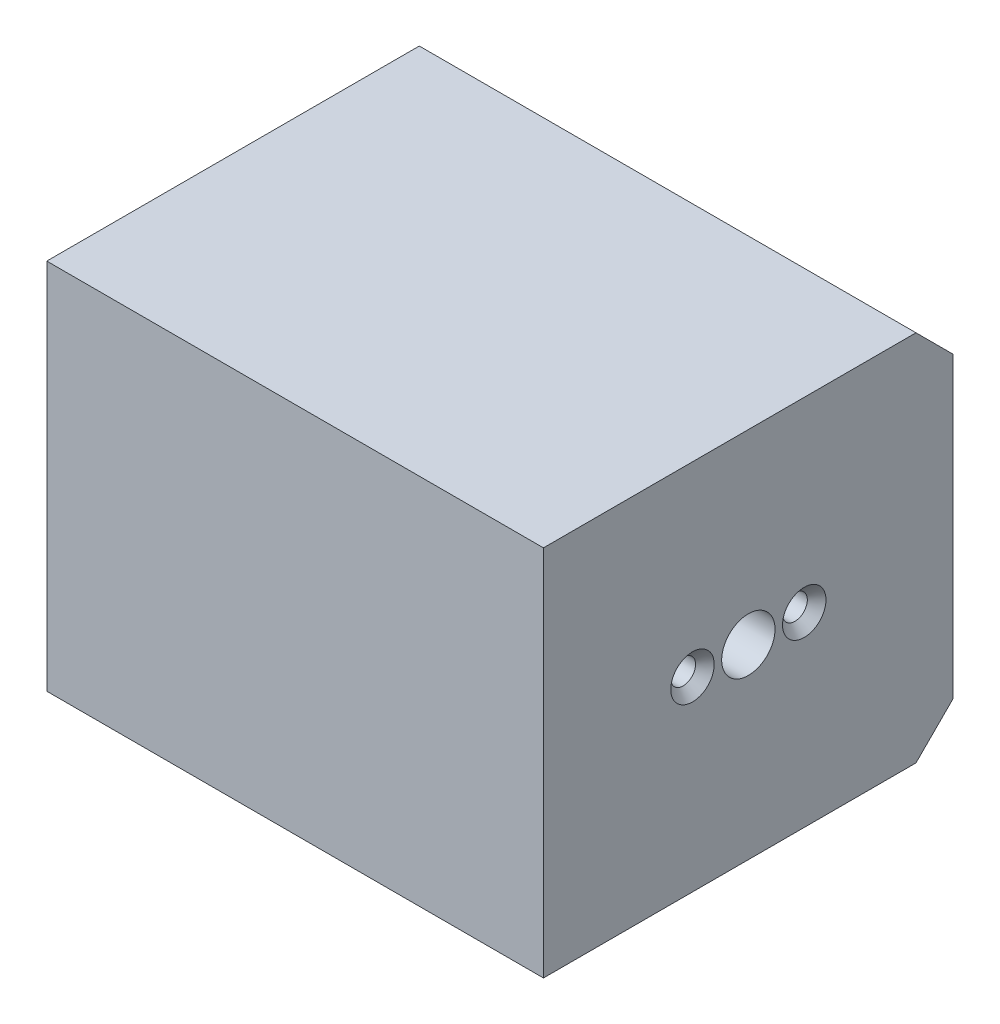
from build123d import *

# Parameters (mm, degrees)
BOSS_EXTRUDE1_DEPTH                             = 23
BOSS_EXTRUDE1_DEPTH_BACK                        = 10
SKETCH1_W                                       = 40
SKETCH1_H                                       = 30
SKETCH1_5_W                                     = 36.6
SKETCH1_5_H                                     = 11
CUT_EXTRUDE1_DEPTH                              = 13
SKETCH2_R                                       = 2.15
CUT_EXTRUDE2_DEPTH                              = 46.755436835
CSK_FOR_M2_FLAT_HEAD_MACHINE_SCREW1_D           = 2
CSK_FOR_M2_FLAT_HEAD_MACHINE_SCREW1_CSINK_D     = 3.5
CSK_FOR_M2_FLAT_HEAD_MACHINE_SCREW1_CSINK_ANGLE = 90
CHAMFER1_SIZE                                   = 3


with BuildPart() as part:
    # Sketch1 → Boss-Extrude1 (new, two sides: drawn at the far end of the back side and taken through both)
    with BuildSketch(Plane.XY.offset(-BOSS_EXTRUDE1_DEPTH_BACK)):
        with Locations((-20, 0)):
            Rectangle(SKETCH1_W, SKETCH1_H)
    extrude(amount=BOSS_EXTRUDE1_DEPTH + BOSS_EXTRUDE1_DEPTH_BACK)

    # Sketch1<5> → Cut-Extrude1 (cut)
    with BuildSketch(Plane.XY):
        with Locations((-21.7, 0)):
            Rectangle(SKETCH1_5_W, SKETCH1_5_H)
    extrude(amount=CUT_EXTRUDE1_DEPTH, mode=Mode.SUBTRACT)

    # Sketch2 → Cut-Extrude2 (cut, through all)
    with BuildSketch(Plane.ZY.offset(3.4)):
        with Locations((6.5, 0)):
            Circle(SKETCH2_R)
    extrude(amount=-CUT_EXTRUDE2_DEPTH, mode=Mode.SUBTRACT)

    # CSK for M2 Flat Head Machine Screw1 (through all)
    with Locations(Plane(origin=(0, 0, 0), x_dir=(0, 0, -1), z_dir=(1, 0, 0))):
        with Locations((-11, 0), (-2, 0)):
            CounterSinkHole(CSK_FOR_M2_FLAT_HEAD_MACHINE_SCREW1_D / 2, CSK_FOR_M2_FLAT_HEAD_MACHINE_SCREW1_CSINK_D / 2, counter_sink_angle=CSK_FOR_M2_FLAT_HEAD_MACHINE_SCREW1_CSINK_ANGLE)

    # Chamfer1
    chamfer1_edges = [part.edges().sort_by_distance(p)[0] for p in [
        (-20, 15, -10),
        (-20, -15, -10),
    ]]
    chamfer(chamfer1_edges, length=CHAMFER1_SIZE)


solid = part.part
